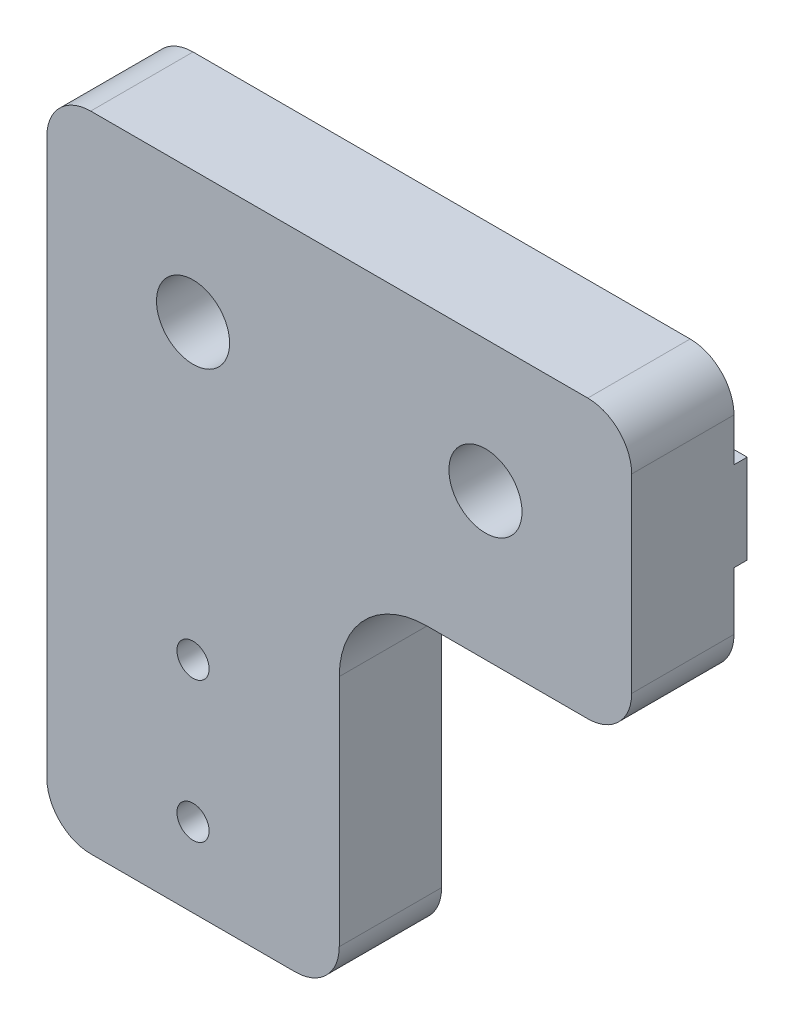
from build123d import *

# Parameters (mm, degrees)
SKETCH1_R           = 2.5
SKETCH1_R_2         = 1.1
BOSS_EXTRUDE1_DEPTH = 7
SKETCH2_W           = 0.9
SKETCH2_H           = 6.1
BOSS_EXTRUDE2_DEPTH = 40
CUT_EXTRUDE1_REACH  = 61.875
SKETCH3_R           = 2.5


with BuildPart() as part:
    # Sketch1 → Boss-Extrude1 (new body)
    with BuildSketch(Plane.XY):
        with BuildLine():
            Line((3, 0), (17, 0))
            ThreePointArc((17, 0), (19.121320344, 0.878679656), (20, 3))
            Line((20, 3), (20, 19))
            ThreePointArc((20, 19), (21.757359313, 23.242640687), (26, 25))
            Line((26, 25), (37, 25))
            ThreePointArc((37, 25), (39.121320344, 25.878679656), (40, 28))
            Line((40, 28), (40, 41))
            ThreePointArc((40, 41), (39.121320344, 43.121320344), (37, 44))
            Line((37, 44), (3, 44))
            ThreePointArc((3, 44), (0.878679656, 43.121320344), (0, 41))
            Line((0, 41), (0, 3))
            ThreePointArc((0, 3), (0.878679656, 0.878679656), (3, 0))
        make_face()
        with Locations((10, 35)):
            Circle(SKETCH1_R, mode=Mode.SUBTRACT)
        with Locations((30, 35)):
            Circle(SKETCH1_R, mode=Mode.SUBTRACT)
        with Locations((10, 5.4)):
            Circle(SKETCH1_R_2, mode=Mode.SUBTRACT)
        with Locations((10, 15)):
            Circle(SKETCH1_R_2, mode=Mode.SUBTRACT)
    extrude(amount=BOSS_EXTRUDE1_DEPTH)

    # Sketch2 → Boss-Extrude2 (add)
    with BuildSketch(Plane(origin=(40, 0, 0), x_dir=(0, 0, -1), z_dir=(1, 0, 0))):
        with Locations((0.45, 35)):
            Rectangle(SKETCH2_W, SKETCH2_H)
    extrude(amount=-BOSS_EXTRUDE2_DEPTH)

    # Sketch3 → Cut-Extrude1 (cut, up to next)
    with BuildSketch(Plane.XY, mode=Mode.PRIVATE) as cut_extrude1_sk1:
        with Locations((10, 35)):
            Circle(SKETCH3_R)
    cut_extrude1_tool1 = extrude(cut_extrude1_sk1.sketch, amount=-CUT_EXTRUDE1_REACH, mode=Mode.PRIVATE) & part.part
    # Sketch3 → Cut-Extrude1 (cut, up to next)
    with BuildSketch(Plane.XY, mode=Mode.PRIVATE) as cut_extrude1_sk2:
        with Locations((30, 35)):
            Circle(SKETCH3_R)
    cut_extrude1_tool2 = extrude(cut_extrude1_sk2.sketch, amount=-CUT_EXTRUDE1_REACH, mode=Mode.PRIVATE) & part.part
    add(cut_extrude1_tool1.solids().sort_by_distance((10, 35, 0))[0], mode=Mode.SUBTRACT)
    add(cut_extrude1_tool2.solids().sort_by_distance((30, 35, 0))[0], mode=Mode.SUBTRACT)


solid = part.part
